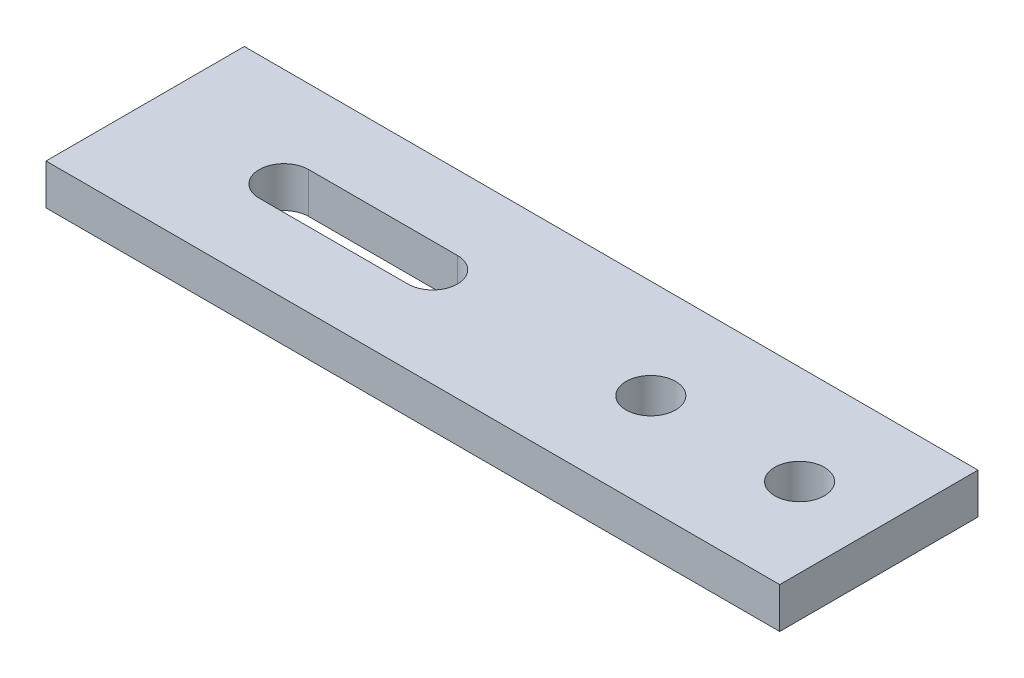
from build123d import *

# Parameters (mm, degrees)
SKETCH_1_W          = 74
SKETCH_1_H          = 20
EXTRUDE_1_DEPTH     = 4.1
SKETCH_2_R          = 2.5
CUT_EXTRUDE_1_DEPTH = 4.1


with BuildPart() as part:
    # 草图1 → 凸台-拉伸1 (new body)
    with BuildSketch(Plane(origin=(0, 0, 0), x_dir=(1, 0, 0), z_dir=(0, 1, 0))):
        with Locations((37, 10)):
            Rectangle(SKETCH_1_W, SKETCH_1_H)
    extrude(amount=EXTRUDE_1_DEPTH)

    # 草图2 → 切除-拉伸1 (cut)
    with BuildSketch(Plane(origin=(0, 4.1, 0), x_dir=(1, 0, 0), z_dir=(0, 1, 0))):
        with Locations(Location((66, 10, 0), (0, 0, 270))):
            Circle(SKETCH_2_R)
        with Locations(Location((51, 10, 0), (0, 0, 270))):
            Circle(SKETCH_2_R)
        with BuildLine():
            Line((14, 12.5), (29, 12.5))
            ThreePointArc((29, 12.5), (31.5, 10), (29, 7.5))
            Line((29, 7.5), (14, 7.5))
            ThreePointArc((14, 7.5), (11.5, 10), (14, 12.5))
        make_face()
    extrude(amount=-CUT_EXTRUDE_1_DEPTH, mode=Mode.SUBTRACT)


solid = part.part
